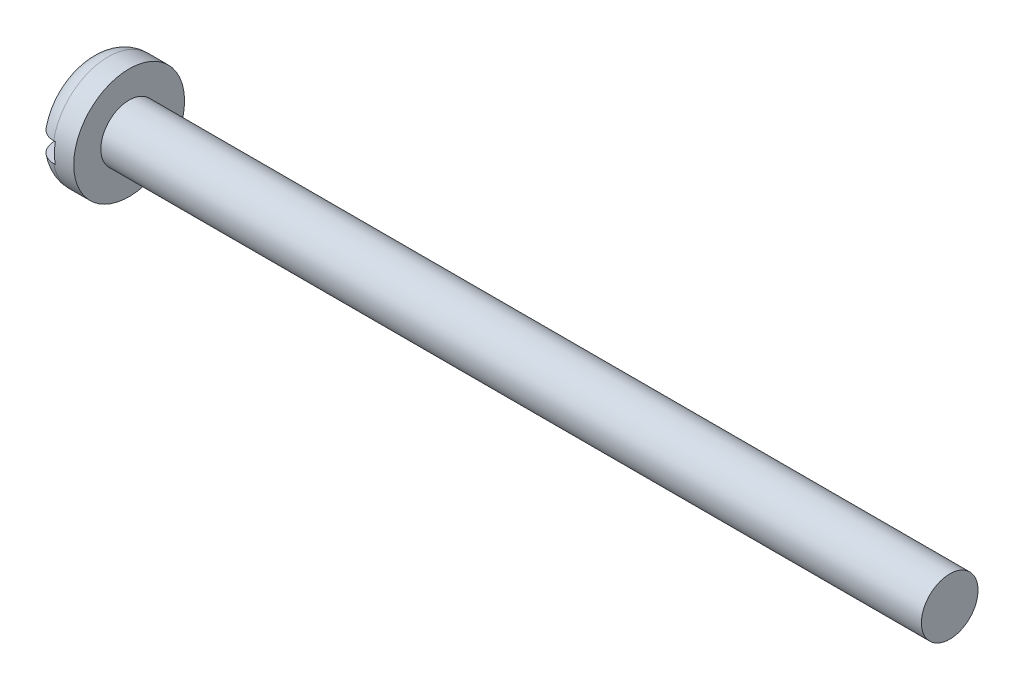
from build123d import *

# Parameters (mm, degrees)
SKETCH2_W  = 6.858
SKETCH2_H  = 1.2192
SLOT_DEPTH = 1.27


with BuildPart() as part:
    # BodySke → Base-Revolve (revolve)
    with BuildSketch(Plane.XY, mode=Mode.PRIVATE) as base_revolve_sk:
        with BuildLine():
            Line((2.4638, 1.7526), (2.4638, 3.429))
            Line((2.4638, 3.429), (1.1684, 3.429))
            ThreePointArc((1.1684, 3.429), (0.342216437, 3.086783563), (0, 2.2606))
            Line((0, 2.2606), (0, 0))
            Line((0, 0), (53.2638, 0))
            Line((53.2638, 0), (53.2638, 1.7526))
            Line((53.2638, 1.7526), (2.4638, 1.7526))
        make_face()
    revolve(base_revolve_sk.sketch.rotate(Axis((-25.4, 0, 0), (1, 0, 0)), 90), axis=Axis((-25.4, 0, 0), (1, 0, 0)))

    # Sketch2 → Slot (cut)
    with BuildSketch(Plane(origin=(0, 0, 0), x_dir=(0, 0, -1), z_dir=(1, 0, 0))):
        Rectangle(SKETCH2_W, SKETCH2_H)
    extrude(amount=SLOT_DEPTH, mode=Mode.SUBTRACT)


solid = part.part
